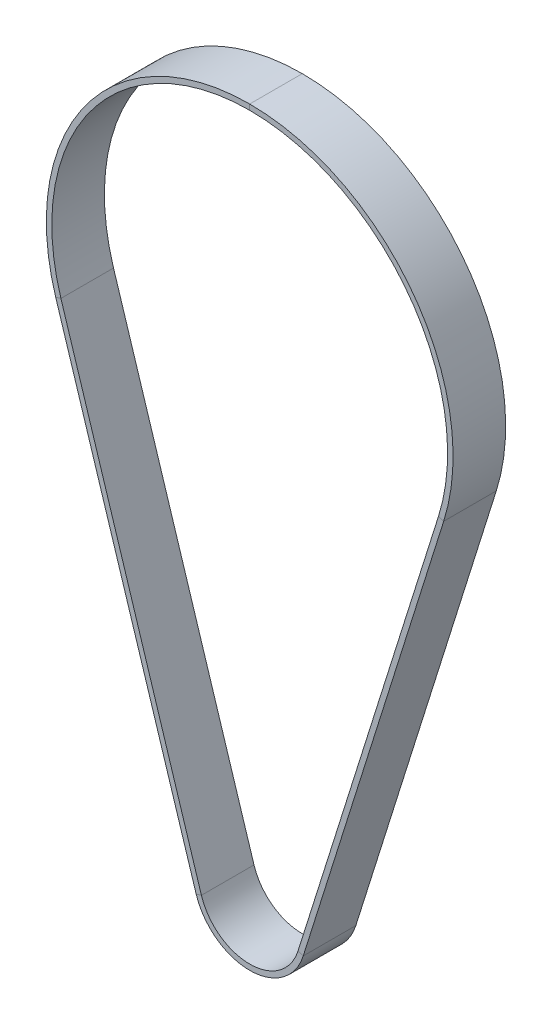
from build123d import *

# Parameters (mm, degrees)
SKETCH_2_W = 15
SKETCH_2_H = 1.56


with BuildPart() as part:
    # По траектории1: sweep along a path in Эскиз1
    with BuildLine(Plane.XY) as sweep_1_path:
        Line((-55.328473682, -17.4), (-15.263027223, -144.8))
        ThreePointArc((-15.263027223, -144.8), (0, -156), (15.263027223, -144.8))
        Line((15.263027223, -144.8), (55.328473682, -17.4))
        ThreePointArc((55.328473682, -17.4), (0, 58), (-55.328473682, -17.4))
    # Эскиз2 → По траектории1 (sweep)
    with BuildSketch(Plane(origin=(0, 0, 0), x_dir=(0, 0, -1), z_dir=(1, 0, 0))):
        with Locations((-7.5, 57.22)):
            Rectangle(SKETCH_2_W, SKETCH_2_H)
    sweep(path=sweep_1_path.line)


solid = part.part
